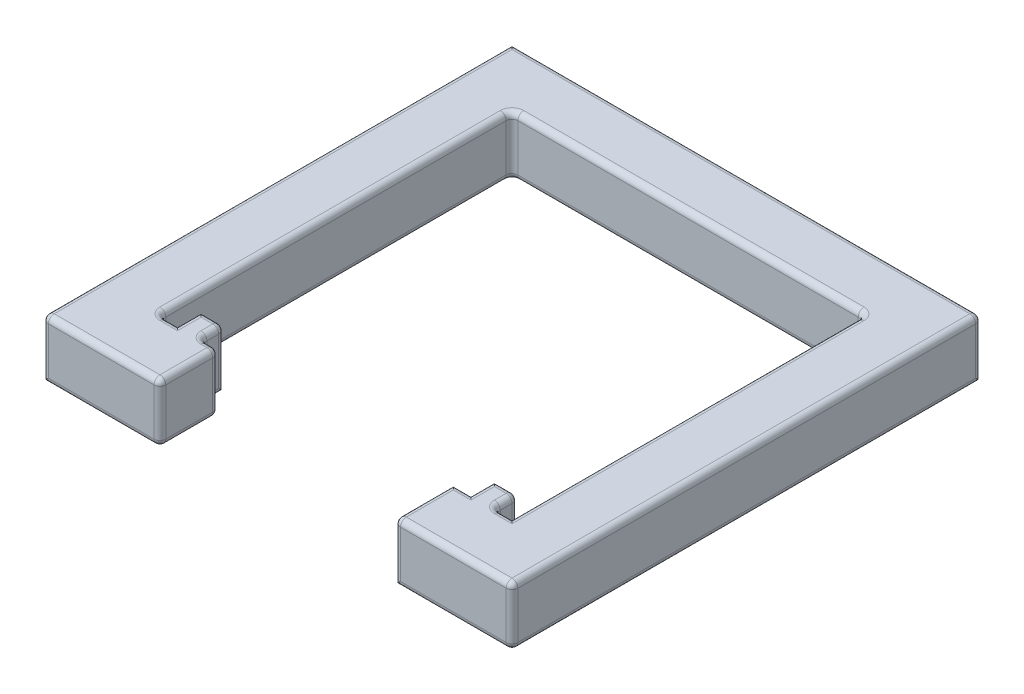
from build123d import *

# Parameters (mm, degrees)
SKETCH1_W           = 2
SKETCH1_H           = 2
BOSS_EXTRUDE1_DEPTH = 5
FILLET1_R           = 0.5


with BuildPart() as part:
    # Sketch1 → Boss-Extrude1 (new body)
    with BuildSketch(Plane(origin=(0, 0, 0), x_dir=(1, 0, 0), z_dir=(0, 1, 0))):
        Polygon((-53.419958922, -370.98752745), (-61.112267161, -370.98752745), (-61.112267161, -380.152018312), (-61.112267161, -410.98752745), (-56.112267161, -410.98752745), (-56.112267161, -405.98752745), (-56.112267161, -375.98752745), (-26.112267161, -375.98752745), (-26.112267161, -405.98752745), (-26.112267161, -410.98752745), (-21.112267161, -410.98752745), (-21.112267161, -380.152018312), (-21.112267161, -370.98752745), align=None)
        Polygon((-56.112267161, -405.98752745), (-56.112267161, -410.98752745), (-51.112267161, -410.98752745), (-51.112267161, -405.98752745), (-52.612267161, -405.98752745), (-54.612267161, -405.98752745), align=None)
        Polygon((-31.112267161, -410.98752745), (-26.112267161, -410.98752745), (-26.112267161, -405.98752745), (-27.612267161, -405.98752745), (-29.612267161, -405.98752745), (-31.112267161, -405.98752745), align=None)
        with Locations((-53.612267161, -404.98752745)):
            Rectangle(SKETCH1_W, SKETCH1_H)
        with Locations((-28.612267161, -404.98752745)):
            Rectangle(SKETCH1_W, SKETCH1_H)
    extrude(amount=BOSS_EXTRUDE1_DEPTH)

    # Fillet1
    fillet1_edges = [part.edges().sort_by_distance(p)[0] for p in [
        (-27.612267161, 5, 404.98752745),
        (-28.612267161, 5, 403.98752745),
        (-41.112267161, 0, 375.98752745),
        (-56.112267161, 0, 390.98752745),
        (-55.362267161, 0, 405.98752745),
        (-29.612267161, 5, 404.98752745),
        (-52.612267161, 0, 404.98752745),
        (-51.862267161, 0, 405.98752745),
        (-51.112267161, 0, 408.48752745),
        (-56.112267161, 0, 410.98752745),
        (-30.362267161, 5, 405.98752745),
        (-21.112267161, 0, 390.98752745),
        (-26.112267161, 0, 410.98752745),
        (-31.112267161, 5, 408.48752745),
        (-27.612267161, 0, 404.98752745),
        (-26.862267161, 0, 405.98752745),
        (-26.112267161, 0, 390.98752745),
        (-26.112267161, 5, 410.98752745),
        (-26.112267161, 2.5, 375.98752745),
        (-56.112267161, 2.5, 375.98752745),
        (-56.112267161, 2.5, 405.98752745),
        (-52.612267161, 2.5, 403.98752745),
        (-52.612267161, 2.5, 405.98752745),
        (-51.112267161, 2.5, 405.98752745),
        (-51.112267161, 2.5, 410.98752745),
        (-61.112267161, 2.5, 410.98752745),
        (-21.112267161, 2.5, 370.98752745),
        (-21.112267161, 2.5, 410.98752745),
        (-31.112267161, 2.5, 410.98752745),
        (-27.612267161, 2.5, 403.98752745),
        (-27.612267161, 2.5, 405.98752745),
        (-26.112267161, 5, 390.98752745),
        (-21.112267161, 5, 390.98752745),
        (-41.112267161, 5, 370.98752745),
        (-61.112267161, 5, 390.98752745),
        (-56.112267161, 5, 410.98752745),
        (-51.112267161, 5, 408.48752745),
        (-51.862267161, 5, 405.98752745),
        (-52.612267161, 5, 404.98752745),
        (-53.612267161, 5, 403.98752745),
        (-54.612267161, 5, 404.98752745),
        (-55.362267161, 5, 405.98752745),
        (-56.112267161, 5, 390.98752745),
        (-26.862267161, 5, 405.98752745),
        (-41.112267161, 5, 375.98752745),
    ]]
    fillet(fillet1_edges, radius=FILLET1_R)


solid = part.part
